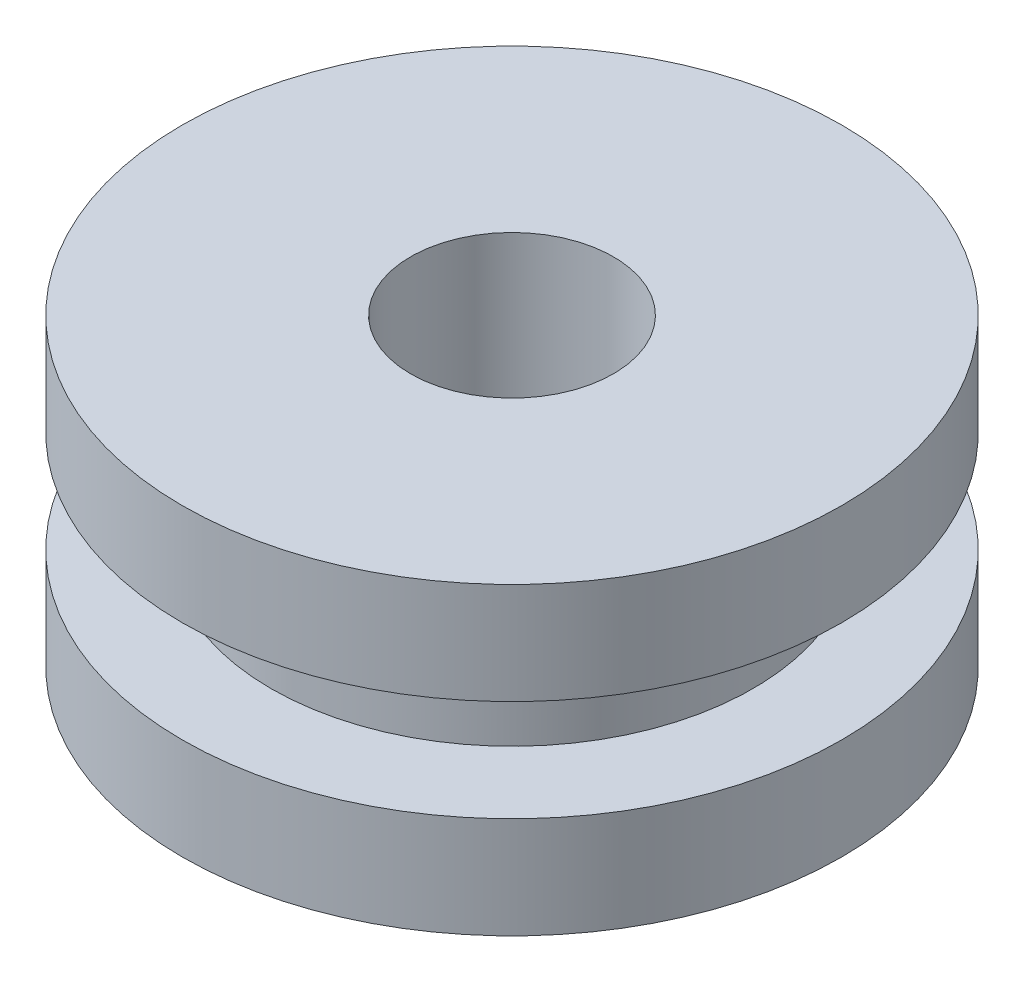
from build123d import *

# Parameters (mm, degrees)
SKETCH_1_R               = 6.5
SKETCH_1_R_2             = 2
EXTRUDE_1_DEPTH          = 6
CUT_EXTRUDE_1_DEPTH      = 1
CUT_EXTRUDE_1_DEPTH_BACK = 1
SKETCH_4_R               = 7
SKETCH_4_R_2             = 4.75


with BuildPart() as part:
    # 草图1 → 凸台-拉伸1 (new body)
    with BuildSketch(Plane(origin=(0, 0, 0), x_dir=(1, 0, 0), z_dir=(0, 1, 0))):
        with Locations(Location((0, 0, 0), (0, 0, 270))):
            Circle(SKETCH_1_R)
        with Locations(Location((0, 0, 0), (0, 0, 270))):
            Circle(SKETCH_1_R_2, mode=Mode.SUBTRACT)
    extrude(amount=EXTRUDE_1_DEPTH)

    # 草图4 → 切除-拉伸1 (cut, two sides: drawn at the far end of the back side and taken through both)
    with BuildSketch(Plane(origin=(0, 3, 0), x_dir=(1, 0, 0), z_dir=(0, 1, 0)).offset(-CUT_EXTRUDE_1_DEPTH_BACK)):
        Circle(SKETCH_4_R)
        with Locations(Location((0, 0, 0), (0, 0, 270))):
            Circle(SKETCH_4_R_2, mode=Mode.SUBTRACT)
    extrude(amount=CUT_EXTRUDE_1_DEPTH + CUT_EXTRUDE_1_DEPTH_BACK, mode=Mode.SUBTRACT)


solid = part.part
